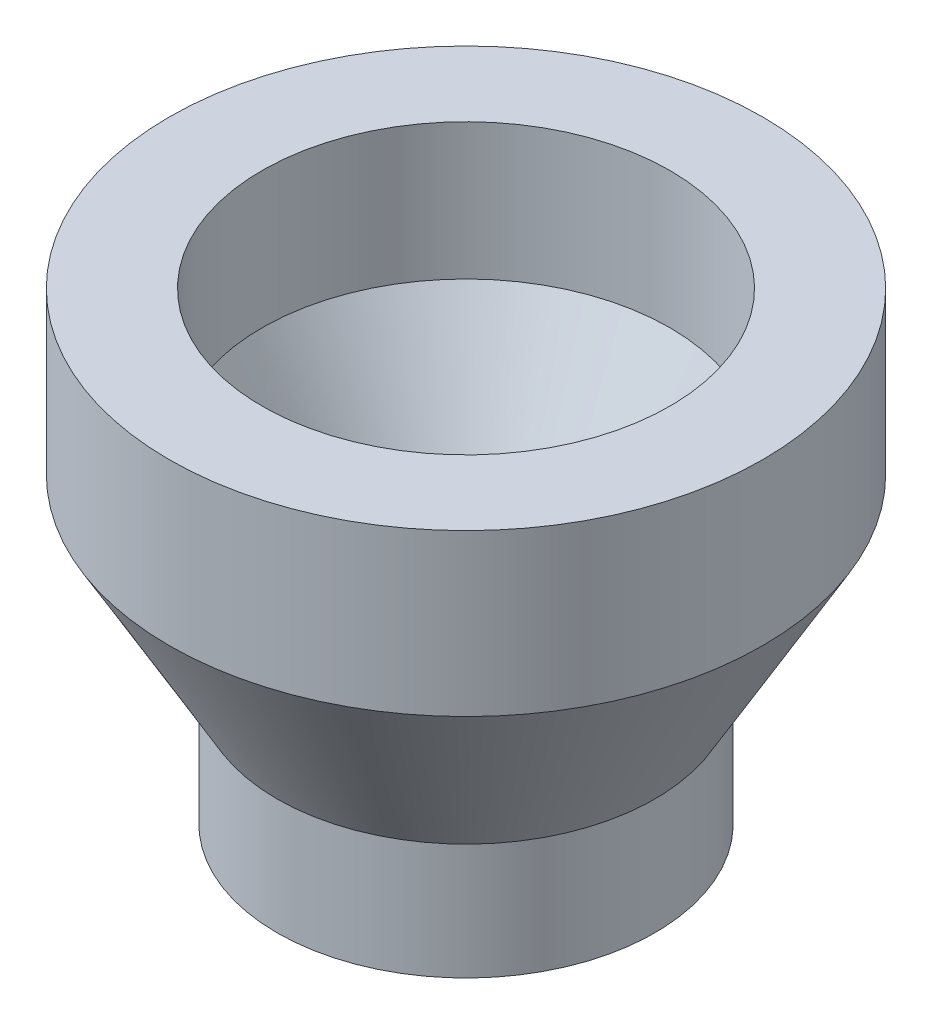
from build123d import *


with BuildPart() as part:
    # 草图1 → 旋转1 (revolve)
    with BuildSketch(Plane.XY, mode=Mode.PRIVATE) as revolve_1_sk:
        Polygon((-4.075, 22), (-4.075, 24.5), (-6.4, 28.527018128), (-6.4, 32), (-4.4, 32), (-4.4, 29.062916512), (-2.575, 25.901923789), (-2.575, 22), align=None)
    revolve(revolve_1_sk.sketch.rotate(Axis((0, 0, 0), (0, 1, 0)), 270), axis=Axis((0, 0, 0), (0, 1, 0)))


solid = part.part
